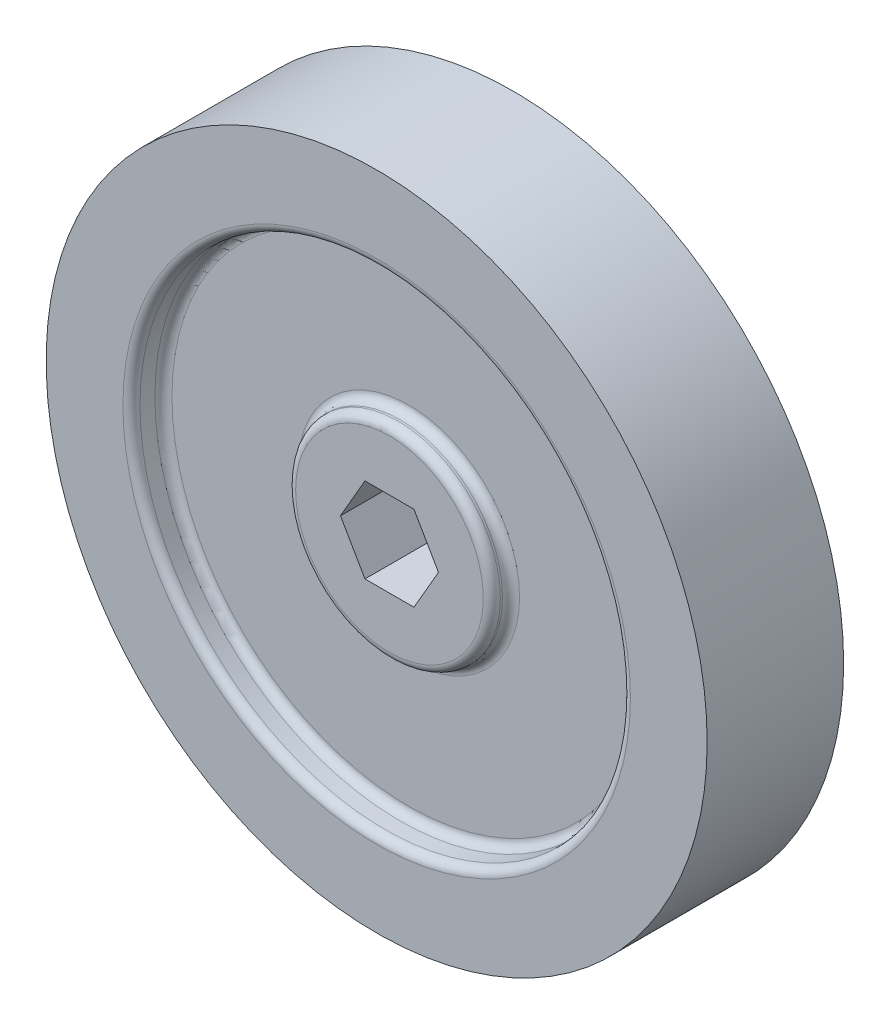
from build123d import *

# Parameters (mm, degrees)
BOSS_EXTRUDE1_DEPTH      = 10.16
BOSS_EXTRUDE1_DEPTH_BACK = 10.16
SKETCH1_R                = 49.2125
CUT_EXTRUDE1_DEPTH       = 73.502708311
FILLET1_R                = 1.27
FILLET2_R                = 1.27


with BuildPart() as part:
    # Sketch1 → Boss-Extrude1 (new, two sides: drawn at the far end of the back side and taken through both)
    with BuildSketch(Plane.XY.offset(-BOSS_EXTRUDE1_DEPTH_BACK)):
        Circle(SKETCH1_R)
    extrude(amount=BOSS_EXTRUDE1_DEPTH + BOSS_EXTRUDE1_DEPTH_BACK)

    # Sketch2 → Cut-Extrude1 (cut, through all)
    with BuildSketch(Plane.XY.offset(10.16)):
        Polygon((3.648853701, 6.32), (-3.648853701, 6.32), (-7.297707403, 0), (-3.648853701, -6.32), (3.648853701, -6.32), (7.297707403, 0), align=None)
    extrude(amount=-CUT_EXTRUDE1_DEPTH, mode=Mode.SUBTRACT)

    # Sketch3 → Cut-Revolve1 (revolve, cut)
    with BuildSketch(Plane(origin=(0, 0, 0), x_dir=(0, 0, -1), z_dir=(1, 0, 0)), mode=Mode.PRIVATE) as cut_revolve1_sk:
        Polygon((8.255, 15.24), (5.3975, 15.24), (5.3975, 36.5125), (10.16, 36.5125), (10.16, 0), (8.255, 0), align=None)
    cut_revolve1 = revolve(cut_revolve1_sk.sketch.rotate(Axis((0, 0, -22.753035396), (0, 0, 1)), 90), axis=Axis((0, 0, -22.753035396), (0, 0, 1)), mode=Mode.SUBTRACT)

    # Fillet1
    fillet1_edges = [part.edges().sort_by_distance(p)[0] for p in [
        (36.5125, 0, -10.16),
        (15.24, 0, -5.3975),
        (15.24, 0, -8.255),
    ]]
    fillet(fillet1_edges, radius=FILLET1_R)

    # Mirror1: Cut-Revolve1 across plane
    add(cut_revolve1.mirror(Plane.XY), mode=Mode.SUBTRACT)

    # Fillet2
    fillet2_edges = [part.edges().sort_by_distance(p)[0] for p in [
        (15.24, 0, 8.255),
        (36.5125, 0, 5.3975),
        (36.5125, 0, 10.16),
        (15.24, 0, 5.3975),
    ]]
    fillet(fillet2_edges, radius=FILLET2_R)


solid = part.part
